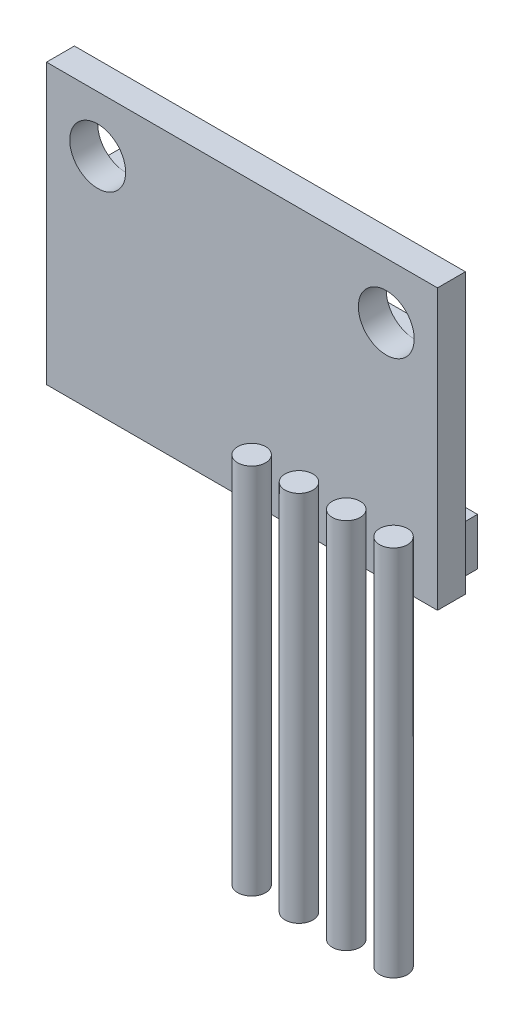
from build123d import *

# Parameters (mm, degrees)
SKETCH2_W                     = 21
SKETCH2_H                     = 15
BOSS_EXTRUDE1_DEPTH           = 1.5
SKETCH3_R                     = 1.5
CUT_EXTRUDE1_DEPTH            = 13.990381057
BOSS_EXTRUDE4_START           = -3
SKETCH7_R                     = 0.75
BOSS_EXTRUDE4_DEPTH           = 20
BOSS_EXTRUDE4_2_DEPTH         = 20
BOSS_EXTRUDE4_3_DEPTH         = 20
BOSS_EXTRUDE4_4_DEPTH         = 20
SKETCH6_W                     = 20.3
SKETCH6_H                     = 2.54
KOPONENTTIEN_TILAVARAUS_DEPTH = 1


with BuildPart() as part:
    # Sketch2 → Boss-Extrude1 (new body)
    with BuildSketch(Plane.XY):
        Rectangle(SKETCH2_W, SKETCH2_H)
    extrude(amount=BOSS_EXTRUDE1_DEPTH)

    # Sketch3 → Cut-Extrude1 (cut, through all)
    with BuildSketch(Plane.XY.offset(1.5)):
        with Locations((-7.75, 4.5)):
            Circle(SKETCH3_R)
        with Locations(Location((7.75, 4.5, 0), (0, 0, 180))):
            Circle(SKETCH3_R)
    extrude(amount=-CUT_EXTRUDE1_DEPTH, mode=Mode.SUBTRACT)

    # Sketch6 → Koponenttien tilavaraus (add)
    with BuildSketch(Plane(origin=(0, 0, 0), x_dir=(-1, 0, 0), z_dir=(0, 0, -1))):
        with Locations((0, -5.73)):
            Rectangle(SKETCH6_W, SKETCH6_H)
        Polygon((-9, 3), (-4, 3), (-4, 6), (4, 6), (4, 3), (9, 3), (9, -1), (-9, -1), align=None)
    extrude(amount=KOPONENTTIEN_TILAVARAUS_DEPTH)


with BuildPart() as body_2:
    # Sketch7 → Boss-Extrude4 (new body)
    with BuildSketch(Plane.XZ.offset(7.5).offset(BOSS_EXTRUDE4_START)):
        with Locations(Location((8.89, 2.25, 0), (0, 0, 270))):
            Circle(SKETCH7_R)
    extrude(amount=BOSS_EXTRUDE4_DEPTH)


with BuildPart() as body_3:
    # Sketch7 → Boss-Extrude4 2 (new body)
    with BuildSketch(Plane.XZ.offset(7.5).offset(BOSS_EXTRUDE4_START)):
        with Locations(Location((6.35, 2.25, 0), (0, 0, 270))):
            Circle(SKETCH7_R)
    extrude(amount=BOSS_EXTRUDE4_2_DEPTH)


with BuildPart() as body_4:
    # Sketch7 → Boss-Extrude4 3 (new body)
    with BuildSketch(Plane.XZ.offset(7.5).offset(BOSS_EXTRUDE4_START)):
        with Locations(Location((3.81, 2.25, 0), (0, 0, 270))):
            Circle(SKETCH7_R)
    extrude(amount=BOSS_EXTRUDE4_3_DEPTH)


with BuildPart() as body_5:
    # Sketch7 → Boss-Extrude4 4 (new body)
    with BuildSketch(Plane.XZ.offset(7.5).offset(BOSS_EXTRUDE4_START)):
        with Locations(Location((1.27, 2.25, 0), (0, 0, 270))):
            Circle(SKETCH7_R)
    extrude(amount=BOSS_EXTRUDE4_4_DEPTH)


solid = Compound([part.part, body_2.part, body_3.part, body_4.part, body_5.part])
